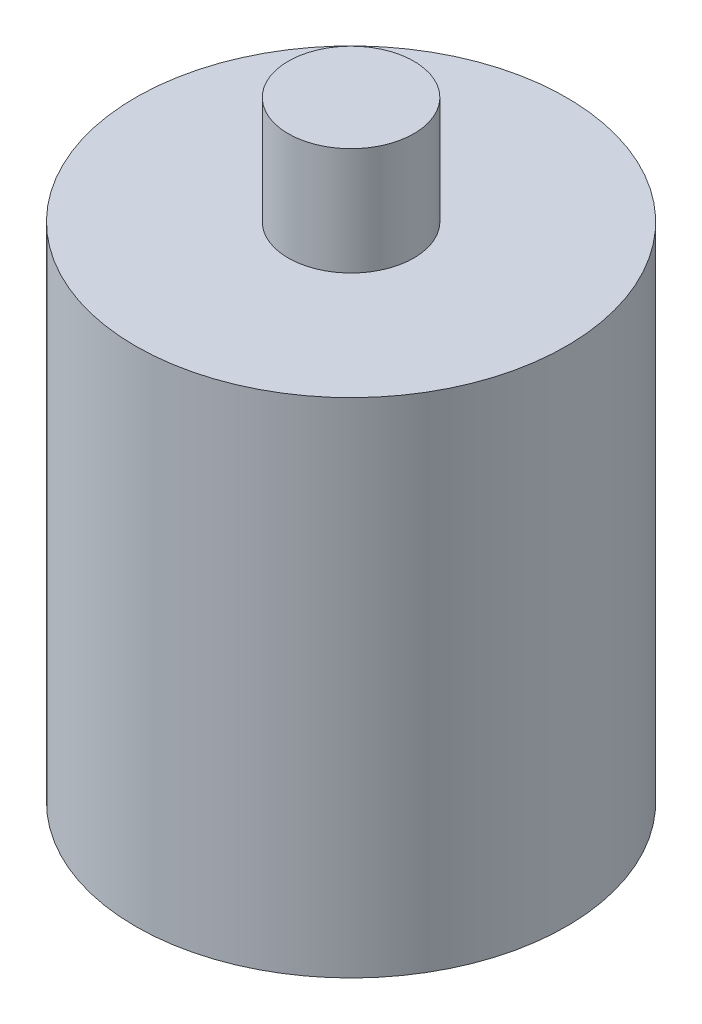
from build123d import *

# Parameters (mm, degrees)
SKETCH1_R           = 6
BOSS_EXTRUDE1_DEPTH = 14
SKETCH2_R           = 1.75
BOSS_EXTRUDE2_DEPTH = 3


with BuildPart() as part:
    # Sketch1 → Boss-Extrude1 (new body)
    with BuildSketch(Plane(origin=(0, 0, 0), x_dir=(1, 0, 0), z_dir=(0, 1, 0))):
        with Locations(Location((0, 0, 0), (0, 0, 270))):
            Circle(SKETCH1_R)
    extrude(amount=BOSS_EXTRUDE1_DEPTH)

    # Sketch2 → Boss-Extrude2 (add)
    with BuildSketch(Plane(origin=(0, 14, 0), x_dir=(1, 0, 0), z_dir=(0, 1, 0))):
        with Locations(Location((0, 0, 0), (0, 0, 270))):
            Circle(SKETCH2_R)
    extrude(amount=BOSS_EXTRUDE2_DEPTH)


solid = part.part
